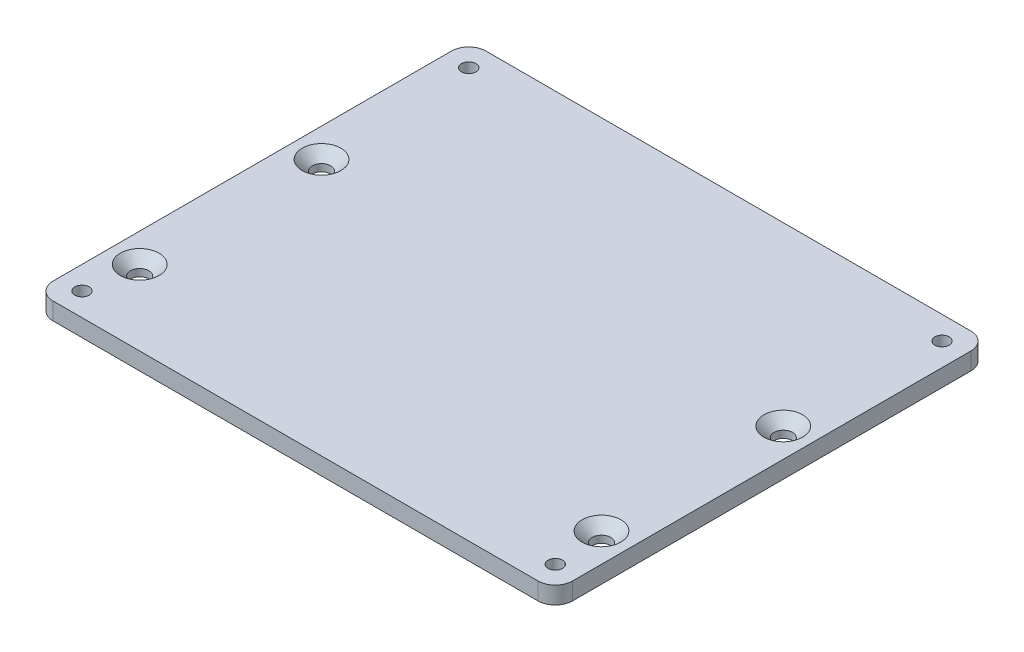
from build123d import *

# Parameters (mm, degrees)
SKETCH1_W                    = 90
SKETCH1_H                    = 75
BOSS_EXTRUDE1_DEPTH          = 3
TAP_DRILL_FOR_M3X0_5_TAP1_D  = 2.5
FILLET1_R                    = 3
CSK_FOR_M3_SFHCS1_AT_2_COUNT = 2
CSK_FOR_M3_SFHCS1_AT_2_PITCH = 31.5
CSK_FOR_M3_SFHCS1_AT_3_COUNT = 2
CSK_FOR_M3_SFHCS1_AT_3_PITCH = 85.97819491
CSK_FOR_M3_SFHCS1_AT_4_COUNT = 2
CSK_FOR_M3_SFHCS1_AT_4_PITCH = 80


with BuildPart() as part:
    # Sketch1 → Boss-Extrude1 (new body)
    with BuildSketch(Plane(origin=(0, 0, 0), x_dir=(1, 0, 0), z_dir=(0, 1, 0))):
        Rectangle(SKETCH1_W, SKETCH1_H)
    extrude(amount=BOSS_EXTRUDE1_DEPTH)

    # Tap Drill for M3x0.5 Tap1 (through all)
    with Locations(Plane(origin=(0, 3, 0), x_dir=(1, 0, 0), z_dir=(0, 1, 0))):
        with Locations((-41, 33.5), (-41, -33.5), (41, -33.5), (41, 33.5)):
            Hole(TAP_DRILL_FOR_M3X0_5_TAP1_D / 2)

    # Fillet1
    fillet1_edges = [part.edges().sort_by_distance(p)[0] for p in [
        (-45, 1.5, -37.5),
        (45, 1.5, -37.5),
        (45, 1.5, 37.5),
        (-45, 1.5, 37.5),
    ]]
    fillet(fillet1_edges, radius=FILLET1_R)

    # Sketch7 → CSK for M3 SFHCS1 (revolve, cut)
    with BuildSketch(Plane(origin=(-40, 3, -7), x_dir=(0, 0, 1), z_dir=(1, 0, 0))):
        Polygon((0, 0), (0, 3), (1.6, 3), (1.6, 1.76), (3.36, 0), align=None)
    csk_for_m3_sfhcs1 = revolve(axis=Axis((-40, 9.35, -7), (0, -1, 0)), mode=Mode.SUBTRACT)

    # CSK for M3 SFHCS1 at 2: CSK for M3 SFHCS1 ×2
    with Locations(*[(0, 0, i * CSK_FOR_M3_SFHCS1_AT_2_PITCH) for i in range(1, CSK_FOR_M3_SFHCS1_AT_2_COUNT)]):
        add(csk_for_m3_sfhcs1, mode=Mode.SUBTRACT)

    # CSK for M3 SFHCS1 at 3: CSK for M3 SFHCS1 ×2
    with Locations(*[Vector(0.9304684761484525, 0, 0.36637196248345316) * (i * CSK_FOR_M3_SFHCS1_AT_3_PITCH) for i in range(1, CSK_FOR_M3_SFHCS1_AT_3_COUNT)]):
        add(csk_for_m3_sfhcs1, mode=Mode.SUBTRACT)

    # CSK for M3 SFHCS1 at 4: CSK for M3 SFHCS1 ×2
    with Locations(*[(i * CSK_FOR_M3_SFHCS1_AT_4_PITCH, 0, 0) for i in range(1, CSK_FOR_M3_SFHCS1_AT_4_COUNT)]):
        add(csk_for_m3_sfhcs1, mode=Mode.SUBTRACT)


solid = part.part
